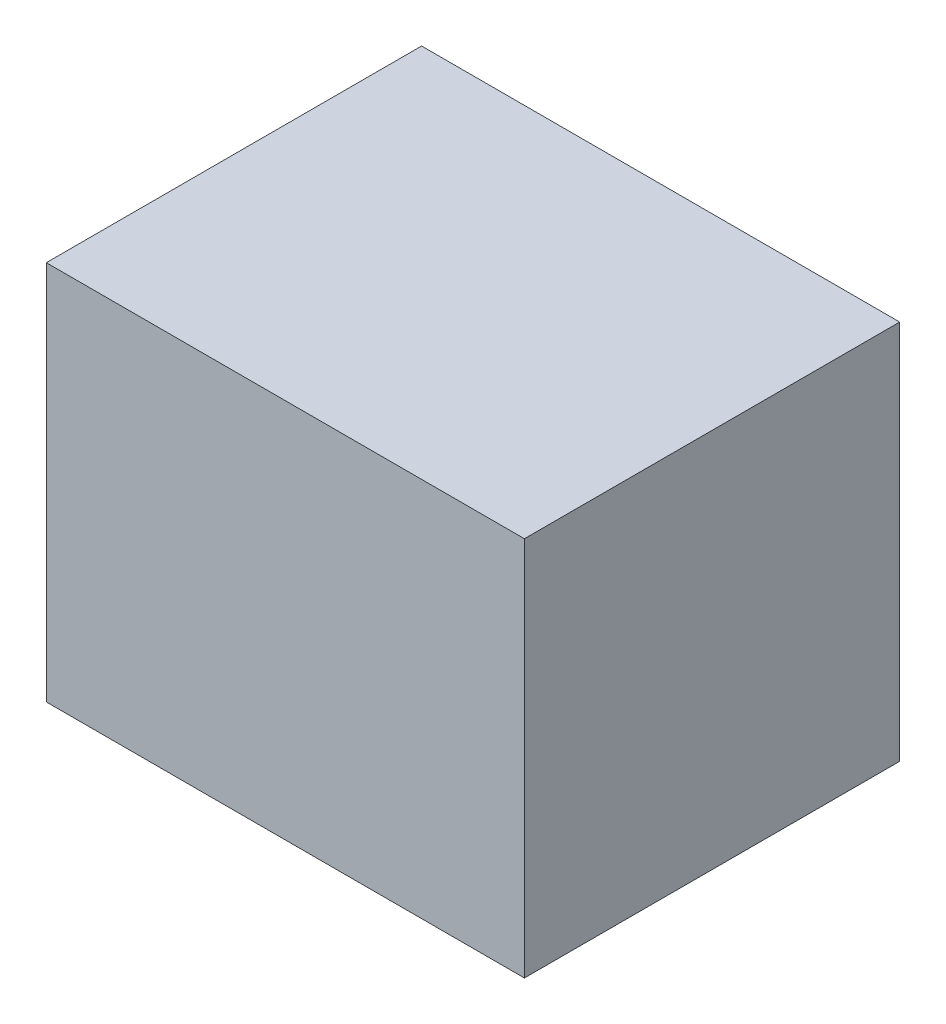
from build123d import *

# Parameters (mm, degrees)
SKETCH1_W           = 93
SKETCH1_H           = 74
BOSS_EXTRUDE1_DEPTH = 36.5


with BuildPart() as part:
    # Sketch1 → Boss-Extrude1 (new, symmetric)
    with BuildSketch(Plane.XY):
        Rectangle(SKETCH1_W, SKETCH1_H)
    extrude(amount=BOSS_EXTRUDE1_DEPTH, both=True)


solid = part.part
